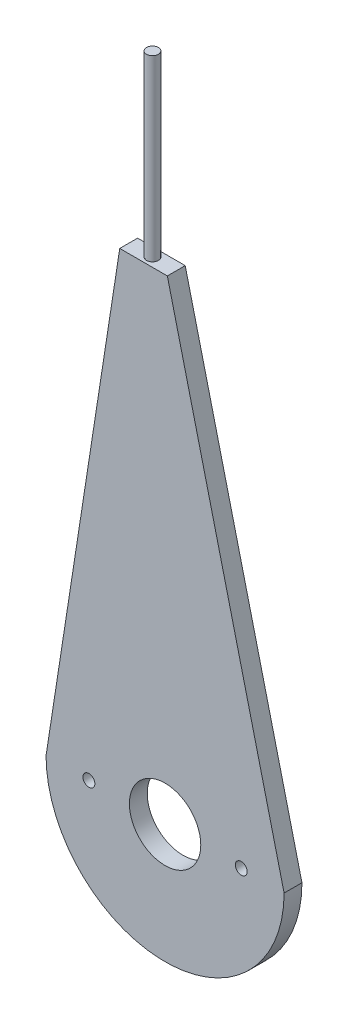
from build123d import *

# Parameters (mm, degrees)
BOSS_EXTRUDE1_DEPTH = 7.5
SKETCH3_R           = 2.5
BOSS_EXTRUDE2_DEPTH = 75
SKETCH4_R           = 15
SKETCH4_R_2         = 2.5
CUT_EXTRUDE1_DEPTH  = 528.574777612


with BuildPart() as part:
    # Sketch1 → Boss-Extrude1 (new body)
    with BuildSketch(Plane.XY):
        with BuildLine():
            Line((-34.236900243, -273.477678772), (-14.236900243, -273.477678772))
            Line((-14.236900243, -273.477678772), (34.807854774, -473.477678772))
            ThreePointArc((34.807854774, -473.477678772), (-15.192145226, -523.477678772), (-65.192145226, -473.477678772))
            Line((-65.192145226, -473.477678772), (-34.236900243, -273.477678772))
        make_face()
    extrude(amount=BOSS_EXTRUDE1_DEPTH)

    # Sketch3 → Boss-Extrude2 (add)
    with BuildSketch(Plane(origin=(0, -273.477678772, 0), x_dir=(1, 0, 0), z_dir=(0, 1, 0))):
        with Locations(Location((-24.236900243, -3.75, 0), (0, 0, 270))):
            Circle(SKETCH3_R)
    extrude(amount=BOSS_EXTRUDE2_DEPTH)

    # Sketch4 → Cut-Extrude1 (cut, through all)
    with BuildSketch(Plane.XY.offset(7.5)):
        with Locations((-15.192145226, -473.477678772)):
            Circle(SKETCH4_R)
        with Locations((16.807854774, -473.477678772)):
            Circle(SKETCH4_R_2)
        with Locations((-47.192145226, -473.477678772)):
            Circle(SKETCH4_R_2)
    extrude(amount=-CUT_EXTRUDE1_DEPTH, mode=Mode.SUBTRACT)


solid = part.part
